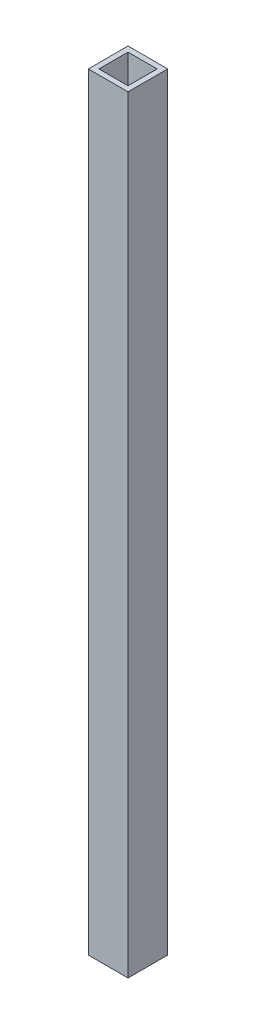
from build123d import *

# Parameters (mm, degrees)
SKETCH1_W           = 15
SKETCH1_H           = 15
SKETCH1_W_2         = 11
SKETCH1_H_2         = 11
BOSS_EXTRUDE1_DEPTH = 290


with BuildPart() as part:
    # Sketch1 → Boss-Extrude1 (new body)
    with BuildSketch(Plane(origin=(0, 0, 0), x_dir=(1, 0, 0), z_dir=(0, 1, 0))):
        with Locations((7.5, 7.5)):
            Rectangle(SKETCH1_W, SKETCH1_H)
        with Locations((7.5, 7.5)):
            Rectangle(SKETCH1_W_2, SKETCH1_H_2, mode=Mode.SUBTRACT)
    extrude(amount=BOSS_EXTRUDE1_DEPTH)


solid = part.part
